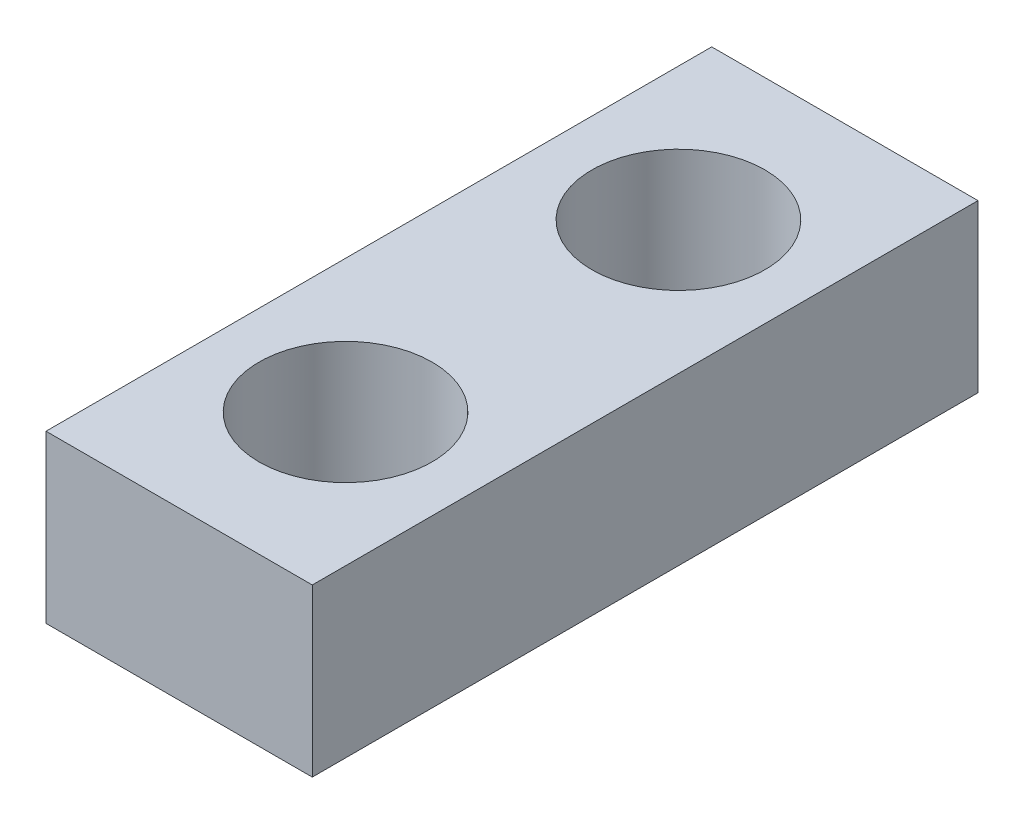
from build123d import *

# Parameters (mm, degrees)
SKETCH1_W           = 10.16
SKETCH1_H           = 25.4
SKETCH1_R           = 3.302
BOSS_EXTRUDE1_DEPTH = 6.35


with BuildPart() as part:
    # Sketch1 → Boss-Extrude1 (new body)
    with BuildSketch(Plane(origin=(0, 0, 0), x_dir=(1, 0, 0), z_dir=(0, 1, 0))):
        with Locations((5.08, 12.7)):
            Rectangle(SKETCH1_W, SKETCH1_H)
        with Locations(Location((5.08, 6.35, 0), (0, 0, 270))):
            Circle(SKETCH1_R, mode=Mode.SUBTRACT)
        with Locations(Location((5.08, 19.05, 0), (0, 0, 270))):
            Circle(SKETCH1_R, mode=Mode.SUBTRACT)
    extrude(amount=BOSS_EXTRUDE1_DEPTH)


solid = part.part
